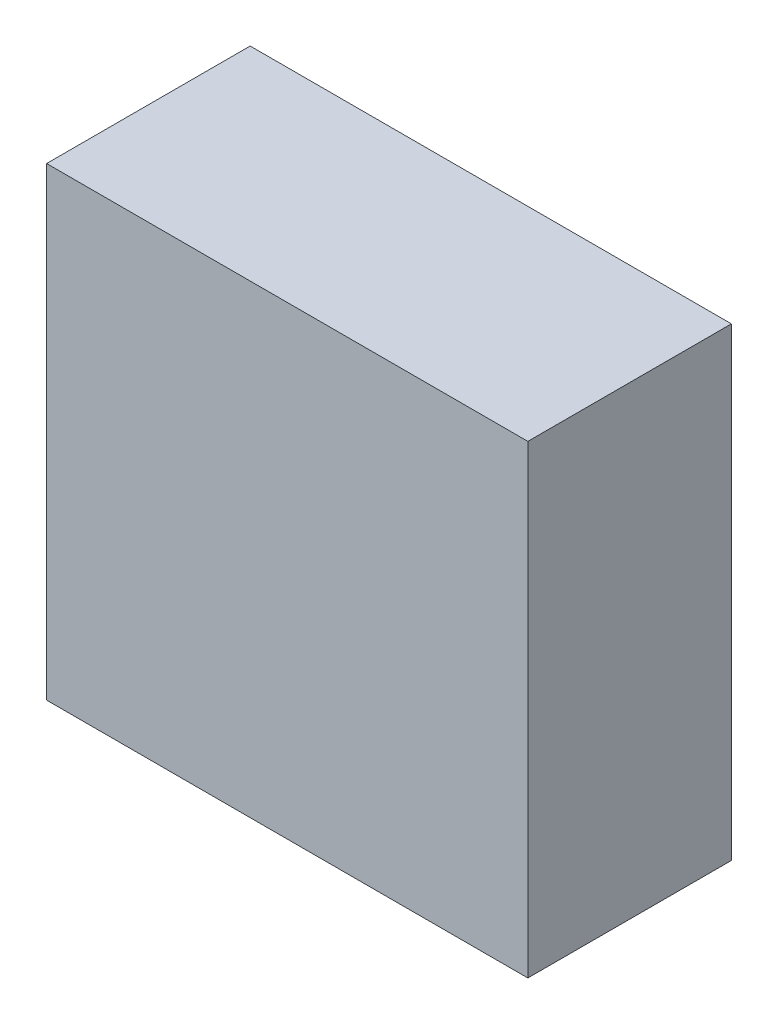
from build123d import *

# Parameters (mm, degrees)
SKETCH1_W         = 29.2
SKETCH1_H         = 12.35
CAMERA_CASE_DEPTH = 28.2


with BuildPart() as part:
    # Sketch1 → Camera Case (new body)
    with BuildSketch(Plane(origin=(0, 17, 0), x_dir=(1, 0, 0), z_dir=(0, 1, 0))):
        with Locations((0, 36.825)):
            Rectangle(SKETCH1_W, SKETCH1_H)
    extrude(amount=CAMERA_CASE_DEPTH)


solid = part.part
